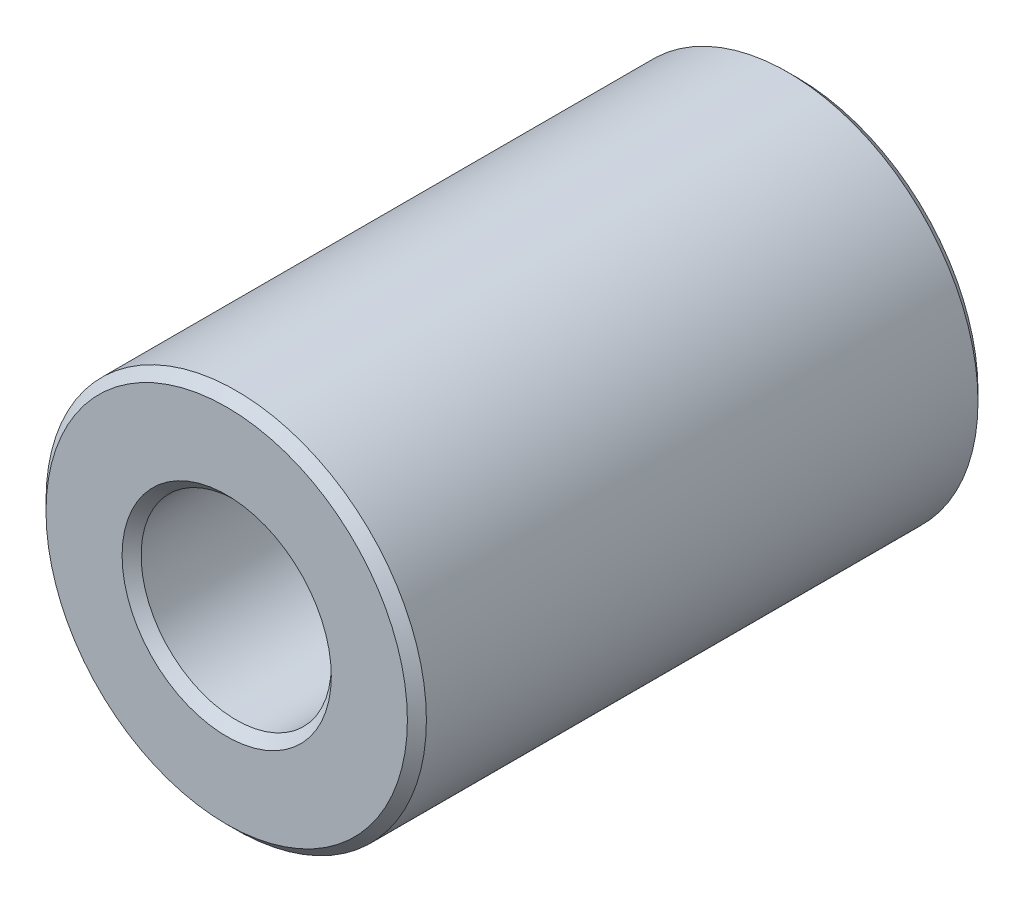
from build123d import *

# Parameters (mm, degrees)
SKETCH_2_R      = 4
SKETCH_2_R_2    = 2
EXTRUDE_1_DEPTH = 6
CHAMFER_1_SIZE  = 0.2


with BuildPart() as part:
    # 草图2 → 凸台-拉伸1 (new, symmetric)
    with BuildSketch(Plane.XY):
        Circle(SKETCH_2_R)
        Circle(SKETCH_2_R_2, mode=Mode.SUBTRACT)
    extrude(amount=EXTRUDE_1_DEPTH, both=True)

    # 倒角1
    chamfer_1_edges = [part.edges().sort_by_distance(p)[0] for p in [
        (-4, 0, -6),
        (-4, 0, 6),
        (-2, 0, -6),
        (-2, 0, 6),
    ]]
    chamfer(chamfer_1_edges, length=CHAMFER_1_SIZE)


solid = part.part
